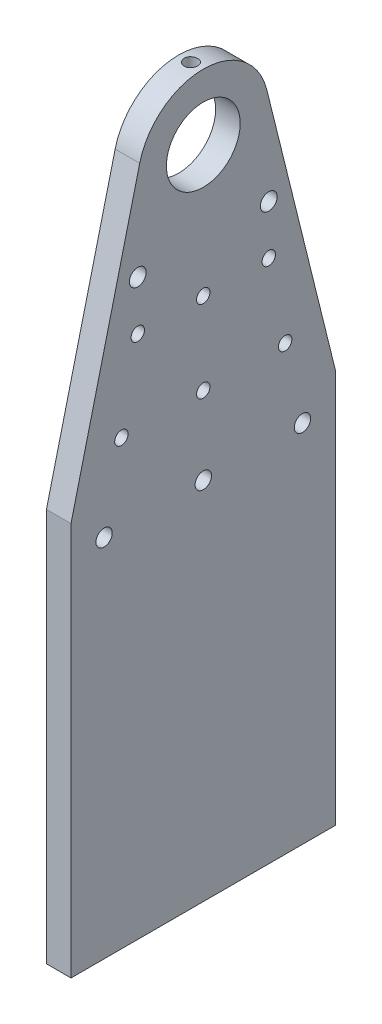
from build123d import *

# Parameters (mm, degrees)
SKETCH2_R               = 14.3129
SKETCH2_R_2             = 3.175
SKETCH2_R_3             = 2.6035
SKETCH2_R_4             = 3.2639
BOSS_EXTRUDE1_DEPTH     = 9.525
CHAMFER1_SIZE           = 4.7625
SKETCH3_R               = 2.6035
CUT_EXTRUDE1_DEPTH      = 25.4
CUT_EXTRUDE2_REACH      = 290.278
CUT_EXTRUDE2_END_RADIUS = 14.3129
SKETCH4_R               = 2.6035


with BuildPart() as part:
    # Sketch2 → Boss-Extrude1 (new body)
    with BuildSketch(Plane(origin=(-47.625, 0, 0), x_dir=(0, 0, -1), z_dir=(1, 0, 0))):
        with BuildLine():
            Line((51.301650802, 73.15), (51.301650802, 85.85))
            Line((51.301650802, 85.85), (24.65662816, 193.550056376))
            ThreePointArc((24.65662816, 193.550056376), (0, 212.85), (-24.65662816, 193.550056376))
            Line((-24.65662816, 193.550056376), (-51.301650802, 85.85))
            Line((-51.301650802, 85.85), (-51.301650802, 73.15))
            Line((-51.301650802, 73.15), (-51.301650802, -66.8))
            Line((-51.301650802, -66.8), (51.301650802, -66.8))
            Line((51.301650802, -66.8), (51.301650802, 73.15))
        make_face()
        with Locations(Location((0, 187.45, 0), (0, 0, 180))):
            Circle(SKETCH2_R, mode=Mode.SUBTRACT)
        with Locations(Location((38.476238101, 74.7375, 0), (0, 0, 180))):
            Circle(SKETCH2_R_2, mode=Mode.SUBTRACT)
        with Locations(Location((0, 74.7375, 0), (0, 0, 180))):
            Circle(SKETCH2_R_2, mode=Mode.SUBTRACT)
        with Locations(Location((-38.476238101, 74.7375, 0), (0, 0, 180))):
            Circle(SKETCH2_R_2, mode=Mode.SUBTRACT)
        with Locations(Location((0, 136.65, 0), (0, 0, 180))):
            Circle(SKETCH2_R_3, mode=Mode.SUBTRACT)
        with Locations(Location((-25.4, 136.65, 0), (0, 0, 180))):
            Circle(SKETCH2_R_3, mode=Mode.SUBTRACT)
        with Locations(Location((-31.75, 104.9, 0), (0, 0, 180))):
            Circle(SKETCH2_R_3, mode=Mode.SUBTRACT)
        with Locations(Location((0, 104.9, 0), (0, 0, 180))):
            Circle(SKETCH2_R_3, mode=Mode.SUBTRACT)
        with Locations(Location((31.75, 104.9, 0), (0, 0, 180))):
            Circle(SKETCH2_R_3, mode=Mode.SUBTRACT)
        with Locations(Location((25.4, 136.65, 0), (0, 0, 180))):
            Circle(SKETCH2_R_3, mode=Mode.SUBTRACT)
        with Locations(Location((-25.4, 155.7, 0), (0, 0, 180))):
            Circle(SKETCH2_R_4, mode=Mode.SUBTRACT)
        with Locations(Location((25.4, 155.7, 0), (0, 0, 180))):
            Circle(SKETCH2_R_4, mode=Mode.SUBTRACT)
    extrude(amount=BOSS_EXTRUDE1_DEPTH)

    # Chamfer1
    chamfer1_edges = [part.edges().sort_by_distance(p)[0] for p in [
        (-47.625, 74.7375, -3.175),
        (-47.625, 74.7375, -41.651238101),
        (-47.625, 74.7375, 35.301238101),
    ]]
    chamfer(chamfer1_edges, length=CHAMFER1_SIZE)

    # Sketch3 → Cut-Extrude1 (cut)
    with BuildSketch(Plane.XZ.offset(66.8)):
        with Locations(Location((-42.8625, -38.476238101, 0), (0, 0, 270))):
            Circle(SKETCH3_R)
        with Locations(Location((-42.8625, 0, 0), (0, 0, 270))):
            Circle(SKETCH3_R)
        with Locations(Location((-42.8625, 38.476238101, 0), (0, 0, 90))):
            Circle(SKETCH3_R)
    extrude(amount=-CUT_EXTRUDE1_DEPTH, mode=Mode.SUBTRACT)

    # Cut-Extrude2: up to this cylinder (the profile starts outside it)
    cut_extrude2_end = Plane(origin=(-42.8625, 187.45, 0), z_dir=(-1, 0, 0)) * Cylinder(CUT_EXTRUDE2_END_RADIUS, 610.1818, mode=Mode.PRIVATE)
    # Sketch4 → Cut-Extrude2 (cut, up to the surface)
    with BuildSketch(Plane(origin=(0, 212.85, 0), x_dir=(-1, 0, 0), z_dir=(0, 1, 0)), mode=Mode.PRIVATE) as cut_extrude2_sk1:
        with Locations(Location((42.8625, 0, 0), (0, 0, 270))):
            Circle(SKETCH4_R)
    cut_extrude2_tool1 = extrude(cut_extrude2_sk1.sketch, amount=-CUT_EXTRUDE2_REACH, mode=Mode.PRIVATE) - cut_extrude2_end
    add(cut_extrude2_tool1.solids().sort_by_distance((-42.8625, 212.85, 0))[0], mode=Mode.SUBTRACT)


solid = part.part
